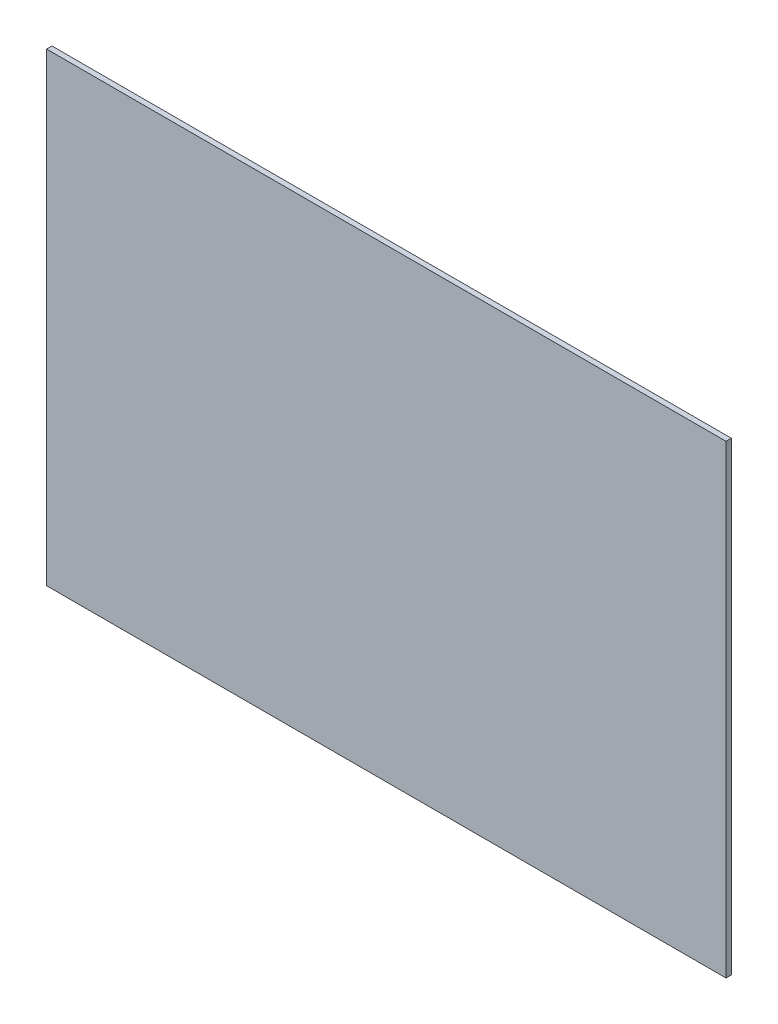
from build123d import *

# Parameters (mm, degrees)
ESQUISSE1_W        = 381.9
ESQUISSE1_H        = 261.3
BOSS_EXTRU_1_DEPTH = 3


with BuildPart() as part:
    # Esquisse1 → Boss.-Extru.1 (new body)
    with BuildSketch(Plane.XY):
        with Locations((190.95, 130.65)):
            Rectangle(ESQUISSE1_W, ESQUISSE1_H)
    extrude(amount=BOSS_EXTRU_1_DEPTH)


solid = part.part
